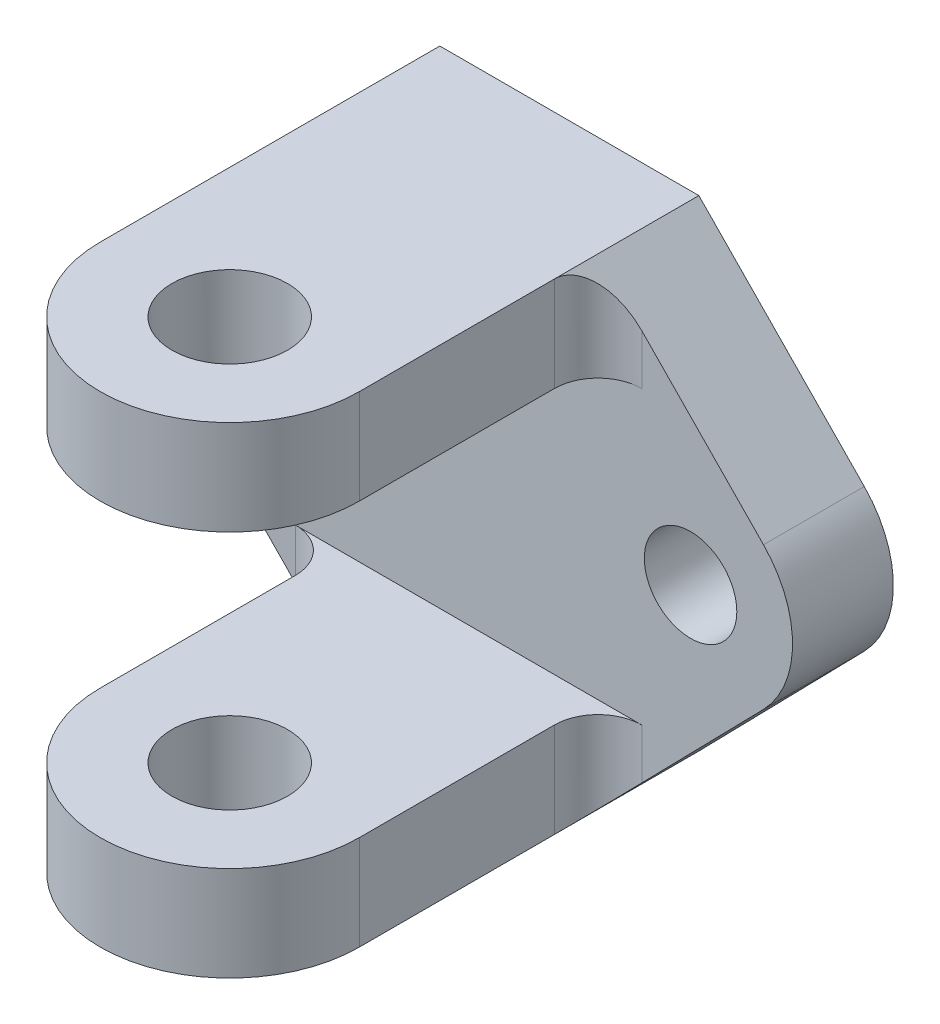
from build123d import *

# Parameters (mm, degrees)
SKETCH1_W                      = 46.48
SKETCH1_H                      = 33.02
SKETCH1_R                      = 3.175
BOSS_EXTRUDE1_DEPTH            = 9.46
SKETCH2_W                      = 46.48
SKETCH2_H                      = 6.51
BOSS_EXTRUDE2_DEPTH            = 53
CUT_EXTRUDE1_REACH             = 70.658
SKETCH4_R                      = 3.96875
CUT_EXTRUDE1_DIRECTION_2_REACH = 70.658
CUT_EXTRUDE3_REACH             = 70.658
CUT_EXTRUDE3_DIRECTION_2_REACH = 70.658
CUT_EXTRUDE4_DEPTH             = 9.46
BOSS_EXTRUDE3_DEPTH            = 9.46
FILLET3_R                      = 3
CUT_EXTRUDE5_DEPTH             = 2.54


with BuildPart() as part:
    # Sketch1 → Boss-Extrude1 (new body)
    with BuildSketch(Plane.XY):
        Rectangle(SKETCH1_W, SKETCH1_H)
        with Locations((15.24, 0)):
            Circle(SKETCH1_R, mode=Mode.SUBTRACT)
        with Locations((-15.24, 0)):
            Circle(SKETCH1_R, mode=Mode.SUBTRACT)
    extrude(amount=BOSS_EXTRUDE1_DEPTH)

    # Sketch2 → Boss-Extrude2 (add)
    with BuildSketch(Plane.XY.offset(9.46)):
        with Locations((0, 13.255)):
            Rectangle(SKETCH2_W, SKETCH2_H)
        with Locations((0, -13.255)):
            Rectangle(SKETCH2_W, SKETCH2_H)
    extrude(amount=BOSS_EXTRUDE2_DEPTH)

    # Cut-Extrude1: up to this face of the body (flat: up to its plane)
    cut_extrude1_end = Plane(part.part.faces().sort_by_distance((0, -16.51, 31.23))[0])
    # Sketch4 → Cut-Extrude1 (cut, up to the picked face)
    with BuildSketch(Plane(origin=(0, 0, 0), x_dir=(1, 0, 0), z_dir=(0, 1, 0)), mode=Mode.PRIVATE) as cut_extrude1_sk1:
        with Locations(Location((0, -25.8481308, 0), (0, 0, 270))):
            Circle(SKETCH4_R)
    cut_extrude1_tool1 = split(extrude(cut_extrude1_sk1.sketch, amount=-CUT_EXTRUDE1_REACH, mode=Mode.PRIVATE), bisect_by=cut_extrude1_end, keep=Keep.BOTH, mode=Mode.PRIVATE)
    add(cut_extrude1_tool1.solids().sort_by(Axis((0, 0, 25.848131), (0, -1, 0)))[0], mode=Mode.SUBTRACT)

    # Cut-Extrude1 direction 2: up to this face of the body (flat: up to its plane)
    cut_extrude1_direction_2_end = Plane(part.part.faces().sort_by_distance((0, 16.51, 31.23))[0])
    # Sketch4 → Cut-Extrude1 direction 2 (cut, up to the picked face)
    with BuildSketch(Plane(origin=(0, 0, 0), x_dir=(1, 0, 0), z_dir=(0, 1, 0)), mode=Mode.PRIVATE) as cut_extrude1_direction_2_sk1:
        with Locations(Location((0, -25.8481308, 0), (0, 0, 270))):
            Circle(SKETCH4_R)
    cut_extrude1_direction_2_tool1 = split(extrude(cut_extrude1_direction_2_sk1.sketch, amount=CUT_EXTRUDE1_DIRECTION_2_REACH, mode=Mode.PRIVATE), bisect_by=cut_extrude1_direction_2_end, keep=Keep.BOTH, mode=Mode.PRIVATE)
    add(cut_extrude1_direction_2_tool1.solids().sort_by(Axis((0, 0, 25.848131), (0, 1, 0)))[0], mode=Mode.SUBTRACT)

    # Cut-Extrude3: up to this face of the body (flat: up to its plane)
    cut_extrude3_end = Plane(part.part.faces().sort_by_distance((0, -16.51, 31.323322986))[0])
    # Sketch6 → Cut-Extrude3 (cut, up to the picked face)
    with BuildSketch(Plane(origin=(0, 0, 0), x_dir=(1, 0, 0), z_dir=(0, 1, 0)), mode=Mode.PRIVATE) as cut_extrude3_sk1:
        with BuildLine():
            Line((-8.89, -25.8481308), (-8.89, -17.46))
            Line((-8.89, -17.46), (-8.89, -9.46))
            Line((-8.89, -9.46), (-16.89, -9.46))
            Line((-16.89, -9.46), (-23.24, -9.46))
            Line((-23.24, -9.46), (-23.24, -62.46))
            Line((-23.24, -62.46), (23.24, -62.46))
            Line((23.24, -62.46), (23.24, -9.46))
            Line((23.24, -9.46), (16.89, -9.46))
            Line((16.89, -9.46), (8.89, -9.46))
            Line((8.89, -9.46), (8.89, -17.46))
            Line((8.89, -17.46), (8.89, -25.8481308))
            ThreePointArc((8.89, -25.8481308), (0, -34.7381308), (-8.89, -25.8481308))
        make_face()
    cut_extrude3_tool1 = split(extrude(cut_extrude3_sk1.sketch, amount=-CUT_EXTRUDE3_REACH, mode=Mode.PRIVATE), bisect_by=cut_extrude3_end, keep=Keep.BOTH, mode=Mode.PRIVATE)
    add(cut_extrude3_tool1.solids().sort_by(Axis((0, 0, 38.948856), (0, -1, 0)))[0], mode=Mode.SUBTRACT)

    # Cut-Extrude3 direction 2: up to this face of the body (flat: up to its plane)
    cut_extrude3_direction_2_end = Plane(part.part.faces().sort_by_distance((0, 16.51, 31.323322986))[0])
    # Sketch6 → Cut-Extrude3 direction 2 (cut, up to the picked face)
    with BuildSketch(Plane(origin=(0, 0, 0), x_dir=(1, 0, 0), z_dir=(0, 1, 0)), mode=Mode.PRIVATE) as cut_extrude3_direction_2_sk1:
        with BuildLine():
            Line((-8.89, -25.8481308), (-8.89, -17.46))
            Line((-8.89, -17.46), (-8.89, -9.46))
            Line((-8.89, -9.46), (-16.89, -9.46))
            Line((-16.89, -9.46), (-23.24, -9.46))
            Line((-23.24, -9.46), (-23.24, -62.46))
            Line((-23.24, -62.46), (23.24, -62.46))
            Line((23.24, -62.46), (23.24, -9.46))
            Line((23.24, -9.46), (16.89, -9.46))
            Line((16.89, -9.46), (8.89, -9.46))
            Line((8.89, -9.46), (8.89, -17.46))
            Line((8.89, -17.46), (8.89, -25.8481308))
            ThreePointArc((8.89, -25.8481308), (0, -34.7381308), (-8.89, -25.8481308))
        make_face()
    cut_extrude3_direction_2_tool1 = split(extrude(cut_extrude3_direction_2_sk1.sketch, amount=CUT_EXTRUDE3_DIRECTION_2_REACH, mode=Mode.PRIVATE), bisect_by=cut_extrude3_direction_2_end, keep=Keep.BOTH, mode=Mode.PRIVATE)
    add(cut_extrude3_direction_2_tool1.solids().sort_by(Axis((0, 0, 38.948856), (0, 1, 0)))[0], mode=Mode.SUBTRACT)

    # Sketch7 → Cut-Extrude4 (cut)
    with BuildSketch(Plane.XY):
        with BuildLine():
            ThreePointArc((-15.24, -7), (-22.24, 0), (-15.24, 7))
            Line((-15.24, 7), (-8.89, 7))
            Line((-8.89, 7), (-8.89, 16.51))
            Line((-8.89, 16.51), (-23.24, 16.51))
            Line((-23.24, 16.51), (-23.24, -16.51))
            Line((-23.24, -16.51), (-8.89, -16.51))
            Line((-8.89, -16.51), (-8.89, -7))
            Line((-8.89, -7), (-15.24, -7))
        make_face()
        with BuildLine():
            Line((8.89, 16.51), (8.89, 7))
            Line((8.89, 7), (15.24, 7))
            ThreePointArc((15.24, 7), (22.24, 0), (15.24, -7))
            Line((15.24, -7), (8.89, -7))
            Line((8.89, -7), (8.89, -16.51))
            Line((8.89, -16.51), (23.24, -16.51))
            Line((23.24, -16.51), (23.24, 16.51))
            Line((23.24, 16.51), (8.89, 16.51))
        make_face()
    extrude(amount=CUT_EXTRUDE4_DEPTH, mode=Mode.SUBTRACT)

    # Sketch8 → Boss-Extrude3 (add)
    with BuildSketch(Plane.XY):
        with BuildLine():
            Line((8.89, -16.51), (20.245691258, -4.893164112))
            ThreePointArc((20.245691258, -4.893164112), (17.955497304, -6.451827213), (15.24, -7))
            Line((15.24, -7), (8.89, -7))
            Line((8.89, -7), (8.89, -16.51))
        make_face()
        with BuildLine():
            ThreePointArc((-20.245691258, -4.893164112), (-17.955497304, -6.451827213), (-15.24, -7))
            Line((-15.24, -7), (-8.89, -7))
            Line((-8.89, -7), (-8.89, -16.51))
            Line((-8.89, -16.51), (-20.245691258, -4.893164112))
        make_face()
        with BuildLine():
            Line((8.89, 16.51), (20.245691258, 4.893164112))
            ThreePointArc((20.245691258, 4.893164112), (17.955497304, 6.451827213), (15.24, 7))
            Line((15.24, 7), (8.89, 7))
            Line((8.89, 7), (8.89, 16.51))
        make_face()
        with BuildLine():
            Line((-8.89, 16.51), (-20.245691258, 4.893164112))
            ThreePointArc((-20.245691258, 4.893164112), (-17.955497304, 6.451827213), (-15.24, 7))
            Line((-15.24, 7), (-8.89, 7))
            Line((-8.89, 7), (-8.89, 16.51))
        make_face()
    extrude(amount=BOSS_EXTRUDE3_DEPTH)

    # Fillet3
    fillet3_edges = [part.edges().sort_by_distance(p)[0] for p in [
        (8.89, -13.255, 9.46),
        (-8.89, -13.255, 9.46),
        (8.89, 13.255, 9.46),
        (-8.89, 13.255, 9.46),
    ]]
    fillet(fillet3_edges, radius=FILLET3_R)

    # Sketch10 → Cut-Extrude5 (cut)
    with BuildSketch(Plane.XY):
        with BuildLine():
            Line((-8.89, 16.51), (-20.245691258, 4.893164112))
            ThreePointArc((-20.245691258, 4.893164112), (-22.24, 0), (-20.245691258, -4.893164112))
            Line((-20.245691258, -4.893164112), (-8.89, -16.51))
            Line((-8.89, -16.51), (8.89, -16.51))
            Line((8.89, -16.51), (20.245691258, -4.893164112))
            ThreePointArc((20.245691258, -4.893164112), (22.24, 0), (20.245691258, 4.893164112))
            Line((20.245691258, 4.893164112), (8.89, 16.51))
            Line((8.89, 16.51), (-8.89, 16.51))
        make_face()
    extrude(amount=CUT_EXTRUDE5_DEPTH, mode=Mode.SUBTRACT)


solid = part.part
